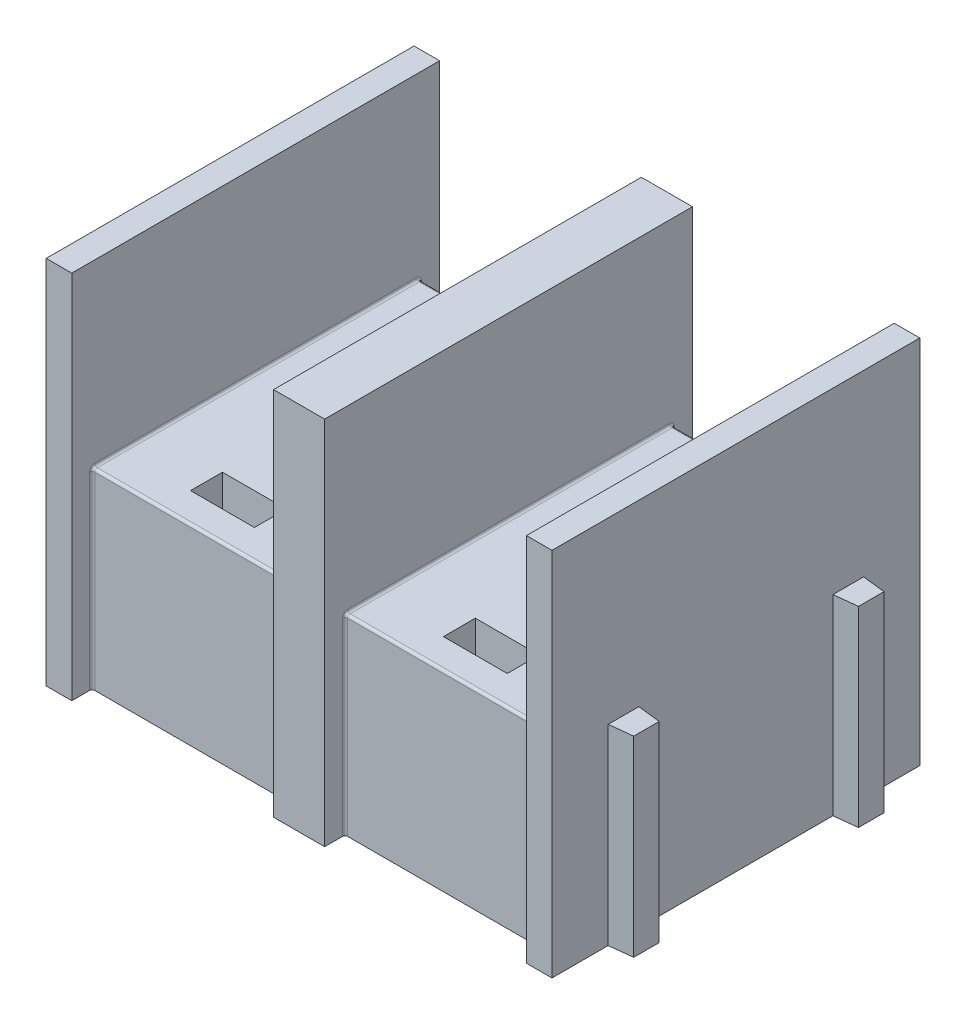
from build123d import *

# Parameters (mm, degrees)
SKETCH1_W               = 19.8
SKETCH1_H               = 14.4
BOSS_EXTRUDE1_DEPTH     = 14.5
SKETCH3_W               = 7.9
SKETCH3_H               = 14.5
CUT_EXTRUDE1_DEPTH      = 0.8
SKETCH4_W               = 7.9
SKETCH4_H               = 7
CUT_EXTRUDE2_DEPTH      = 23.208556909
MIRROR2_COPY_1_SKETCH_W = 7.9
MIRROR2_COPY_1_SKETCH_H = 14.5
MIRROR2_COPY_1_DEPTH    = 0.8
BOSS_EXTRUDE2_DEPTH     = 7.5
FILLET1_R               = 0.1
CUT_EXTRUDE3_DEPTH      = 7.5
SKETCH7_R               = 1
CUT_EXTRUDE4_DEPTH      = 5
SKETCH8_W               = 2.5
SKETCH8_H               = 1.25
CUT_EXTRUDE5_DEPTH      = 2.5


with BuildPart() as part:
    # Sketch1 → Boss-Extrude1 (new body)
    with BuildSketch(Plane(origin=(0, 0, 0), x_dir=(1, 0, 0), z_dir=(0, 1, 0))):
        Rectangle(SKETCH1_W, SKETCH1_H)
    extrude(amount=BOSS_EXTRUDE1_DEPTH)

    # Sketch3 → Cut-Extrude1 (cut)
    with BuildSketch(Plane.XY.offset(7.2)):
        with Locations((4.95, 7.25)):
            Rectangle(SKETCH3_W, SKETCH3_H)
    cut_extrude1 = extrude(amount=-CUT_EXTRUDE1_DEPTH, mode=Mode.SUBTRACT)

    # Mirror1: Cut-Extrude1 across plane
    add(cut_extrude1.mirror(Plane.XY), mode=Mode.SUBTRACT)

    # Sketch4 → Cut-Extrude2 (cut, through all)
    with BuildSketch(Plane.XY.offset(6.4)):
        with Locations((4.95, 11)):
            Rectangle(SKETCH4_W, SKETCH4_H)
    cut_extrude2 = extrude(amount=-CUT_EXTRUDE2_DEPTH, mode=Mode.SUBTRACT)

    # Mirror2: Cut-Extrude1, Cut-Extrude2 across plane
    add(cut_extrude1.mirror(Plane(origin=(0, 0, 0), x_dir=(0, 0, 1), z_dir=(1, 0, 0))), mode=Mode.SUBTRACT)
    add(cut_extrude2.mirror(Plane(origin=(0, 0, 0), x_dir=(0, 0, 1), z_dir=(1, 0, 0))), mode=Mode.SUBTRACT)

    # Mirror2 copy 1 sketch → Mirror2 copy 1 (cut)
    with BuildSketch(Plane(origin=(0, 0, -7.2), x_dir=(-1, 0, 0), z_dir=(0, 0, -1))):
        with Locations((4.95, 7.25)):
            Rectangle(MIRROR2_COPY_1_SKETCH_W, MIRROR2_COPY_1_SKETCH_H)
    extrude(amount=-MIRROR2_COPY_1_DEPTH, mode=Mode.SUBTRACT)

    # Sketch5 → Boss-Extrude2 (add)
    with BuildSketch(Plane(origin=(0, 7.5, 0), x_dir=(1, 0, 0), z_dir=(0, 1, 0))):
        Polygon((9.9, 5), (9.9, 3.8), (10.8, 3.9), (10.8, 4.9), align=None)
        Polygon((9.9, -5), (9.9, -3.8), (10.8, -3.9), (10.8, -4.9), align=None)
    extrude(amount=-BOSS_EXTRUDE2_DEPTH)

    # Fillet1
    fillet1_edges = [part.edges().sort_by_distance(p)[0] for p in [
        (-8.9, 3.75, 6.4),
        (-1, 3.75, 6.4),
        (8.9, 3.75, 6.4),
        (8.9, 3.75, -6.4),
        (1, 3.75, -6.4),
        (4.95, 7.5, -6.4),
        (1, 3.75, 6.4),
        (1, 7.5, 0),
        (8.9, 7.5, 0),
        (4.95, 7.5, 6.4),
        (-8.9, 3.75, -6.4),
        (-1, 3.75, -6.4),
        (-4.95, 7.5, -6.4),
        (-1, 7.5, 0),
        (-4.95, 7.5, 6.4),
        (-8.9, 7.5, 0),
    ]]
    fillet(fillet1_edges, radius=FILLET1_R)

    # Sketch6 → Cut-Extrude3 (cut)
    with BuildSketch(Plane(origin=(0, 7.5, 0), x_dir=(1, 0, 0), z_dir=(0, 1, 0))):
        Polygon((-9.9, 5.05), (-9.9, 3.75), (-8.9, 3.85), (-8.9, 4.95), align=None)
        Polygon((-9.9, -5.05), (-9.9, -3.75), (-8.9, -3.85), (-8.9, -4.95), align=None)
    extrude(amount=-CUT_EXTRUDE3_DEPTH, mode=Mode.SUBTRACT)

    # Sketch7 → Cut-Extrude4 (cut)
    with BuildSketch(Plane.XZ):
        with Locations(Location((-5, -4.4, 0), (0, 0, 270))):
            Circle(SKETCH7_R)
        with Locations(Location((5, -4.4, 0), (0, 0, 270))):
            Circle(SKETCH7_R)
    extrude(amount=-CUT_EXTRUDE4_DEPTH, mode=Mode.SUBTRACT)

    # Sketch8 → Cut-Extrude5 (cut)
    with BuildSketch(Plane(origin=(0, 7.5, 0), x_dir=(1, 0, 0), z_dir=(0, 1, 0))):
        with Locations((4.95, 4.625)):
            Rectangle(SKETCH8_W, SKETCH8_H)
        with Locations((4.95, -4.625)):
            Rectangle(SKETCH8_W, SKETCH8_H)
    cut_extrude5 = extrude(amount=-CUT_EXTRUDE5_DEPTH, mode=Mode.SUBTRACT)

    # Mirror3: Cut-Extrude5 across plane
    add(cut_extrude5.mirror(Plane(origin=(0, 0, 0), x_dir=(0, 0, 1), z_dir=(1, 0, 0))), mode=Mode.SUBTRACT)


solid = part.part
